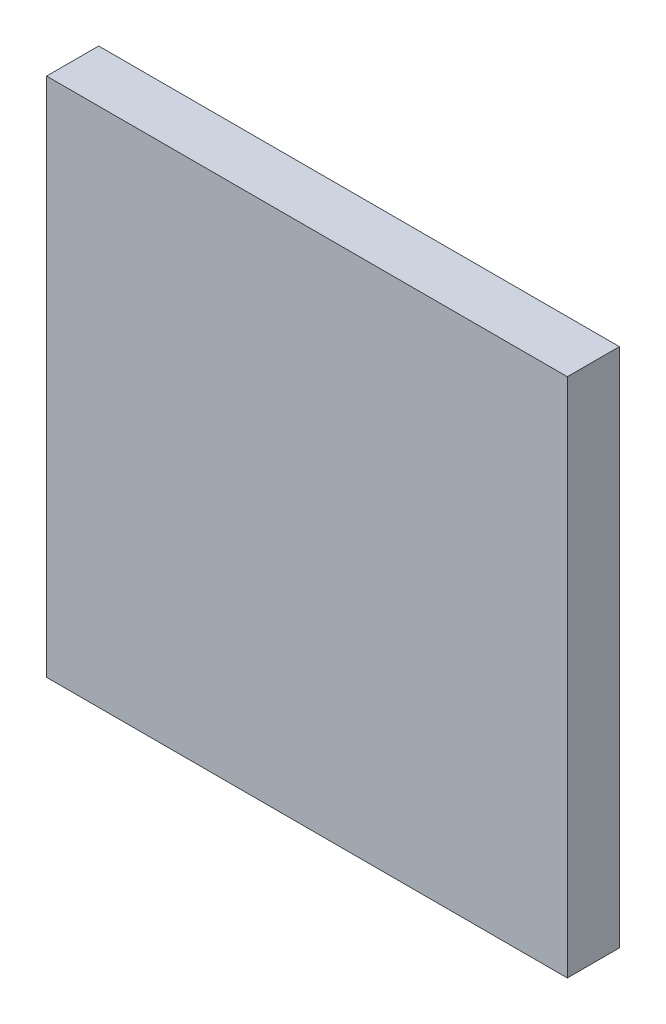
from build123d import *

# Parameters (mm, degrees)
ESQUISSE1_W        = 30
ESQUISSE1_H        = 30
BOSS_EXTRU_1_DEPTH = 3
BOSS_EXTRU_2_DEPTH = 2.5


with BuildPart() as part:
    # Esquisse1 → Boss.-Extru.1 (new body)
    with BuildSketch(Plane.XY):
        with Locations((15, -15)):
            Rectangle(ESQUISSE1_W, ESQUISSE1_H)
    extrude(amount=BOSS_EXTRU_1_DEPTH)

    # Esquisse4 → Boss.-Extru.2 (add, symmetric)
    with BuildSketch(Plane.ZY.offset(-15)):
        with BuildLine():
            Line((0, -12.173324278), (0, -13.673324278))
            ThreePointArc((0, -13.673324278), (-5.548147475, -15.256657612), (0, -16.839990945))
            Line((0, -16.839990945), (0, -18.339990945))
            ThreePointArc((0, -18.339990945), (-6.548147475, -15.256657612), (0, -12.173324278))
        make_face()
    extrude(amount=BOSS_EXTRU_2_DEPTH, both=True)


solid = part.part
